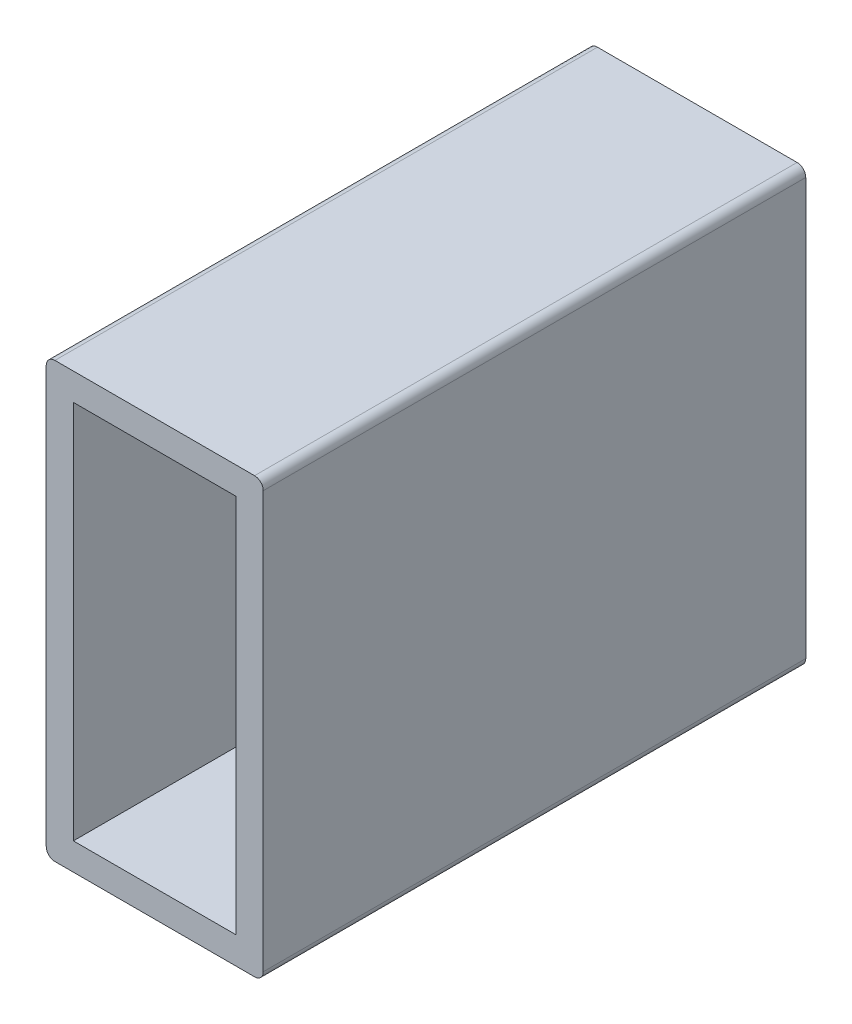
from build123d import *

# Parameters (mm, degrees)
SKETCH1_W           = 19.05
SKETCH1_H           = 44.45
BOSS_EXTRUDE1_DEPTH = 31.75


with BuildPart() as part:
    # Sketch1 → Boss-Extrude1 (new, symmetric)
    with BuildSketch(Plane.XY):
        with BuildLine():
            Line((-11.684, -25.4), (11.684, -25.4))
            ThreePointArc((11.684, -25.4), (12.40242049, -25.10242049), (12.7, -24.384))
            Line((12.7, -24.384), (12.7, 24.384))
            ThreePointArc((12.7, 24.384), (12.40242049, 25.10242049), (11.684, 25.4))
            Line((11.684, 25.4), (-11.684, 25.4))
            ThreePointArc((-11.684, 25.4), (-12.40242049, 25.10242049), (-12.7, 24.384))
            Line((-12.7, 24.384), (-12.7, -24.384))
            ThreePointArc((-12.7, -24.384), (-12.40242049, -25.10242049), (-11.684, -25.4))
        make_face()
        Rectangle(SKETCH1_W, SKETCH1_H, mode=Mode.SUBTRACT)
    extrude(amount=BOSS_EXTRUDE1_DEPTH, both=True)


solid = part.part
